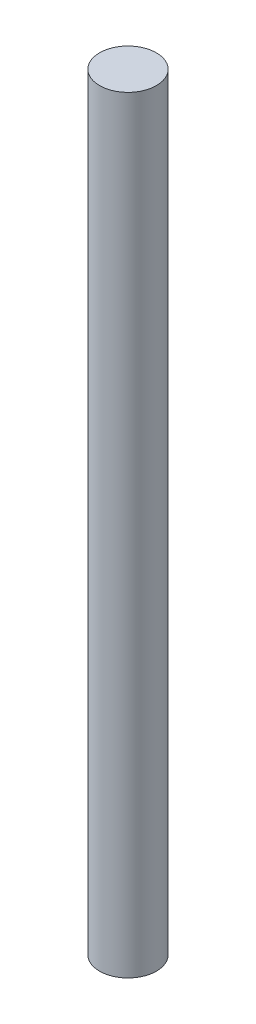
from build123d import *

# Parameters (mm, degrees)
SKETCH1_R           = 1.5
BOSS_EXTRUDE1_DEPTH = 40.5


with BuildPart() as part:
    # Sketch1 → Boss-Extrude1 (new body)
    with BuildSketch(Plane(origin=(0, 0, 0), x_dir=(1, 0, 0), z_dir=(0, 1, 0))):
        with Locations(Location((0, 0, 0), (0, 0, 270))):
            Circle(SKETCH1_R)
    extrude(amount=BOSS_EXTRUDE1_DEPTH)


solid = part.part
